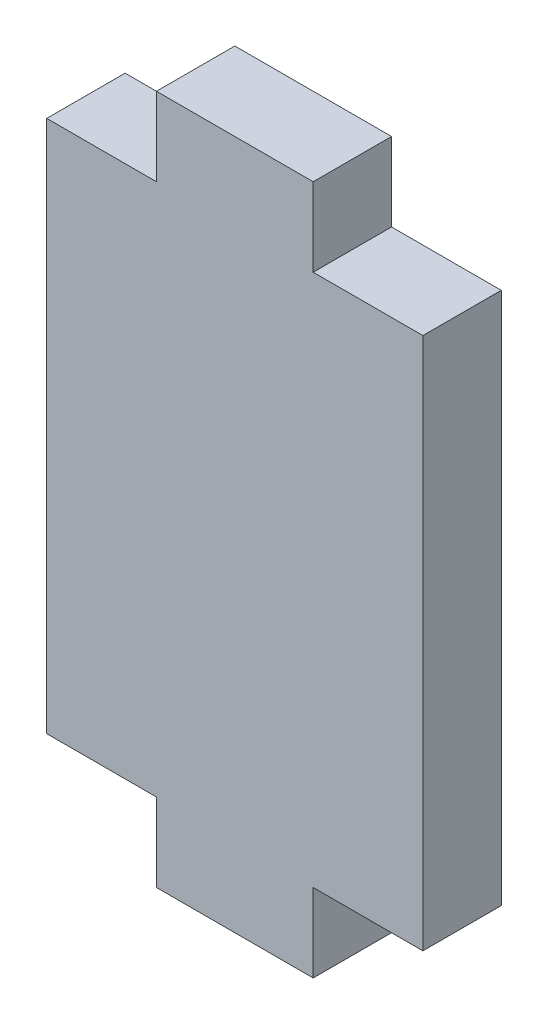
from build123d import *

# Parameters (mm, degrees)
SKETCH1_W           = 48
SKETCH1_H           = 88
BOSS_EXTRUDE1_DEPTH = 10
SKETCH2_W           = 28
SKETCH2_H           = 20
CUT_EXTRUDE1_DEPTH  = 10


with BuildPart() as part:
    # Sketch1 → Boss-Extrude1 (new body)
    with BuildSketch(Plane.XY):
        Rectangle(SKETCH1_W, SKETCH1_H)
    extrude(amount=BOSS_EXTRUDE1_DEPTH)

    # Sketch2 → Cut-Extrude1 (cut)
    with BuildSketch(Plane.XY.offset(10)):
        with Locations((-24, 44)):
            Rectangle(SKETCH2_W, SKETCH2_H)
        with Locations((24, 44)):
            Rectangle(SKETCH2_W, SKETCH2_H)
        with Locations((24, -44)):
            Rectangle(SKETCH2_W, SKETCH2_H)
        with Locations((-24, -44)):
            Rectangle(SKETCH2_W, SKETCH2_H)
    extrude(amount=-CUT_EXTRUDE1_DEPTH, mode=Mode.SUBTRACT)


solid = part.part
